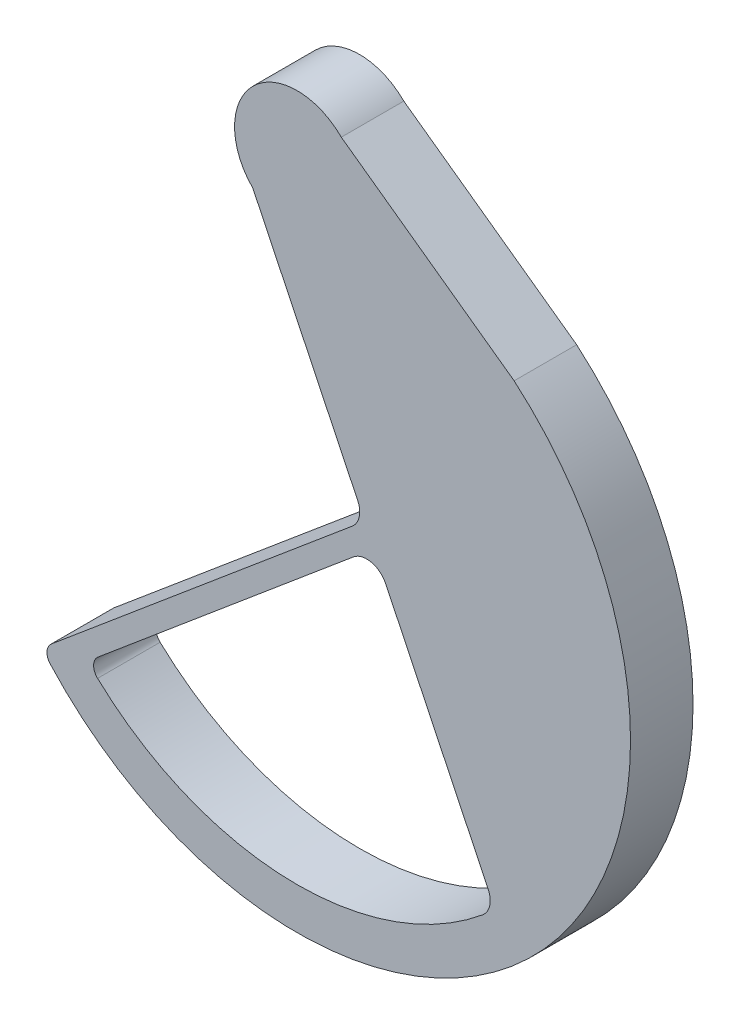
from build123d import *

# Parameters (mm, degrees)
EXTRUDE_1_DEPTH     = 15
SKETCH_9_R          = 10
CUT_EXTRUDE_3_DEPTH = 2


with BuildPart() as part:
    # ｽｹｯﾁ4 → ﾎﾞｽ - 押し出し1 (new body)
    with BuildSketch(Plane.XY):
        with BuildLine():
            Line((-53.623111018, -124.995132678), (-58.940636287, -129.45706617))
            ThreePointArc((-58.940636287, -129.45706617), (-60.005384698, -131.552012131), (-59.233530865, -133.771635843))
            ThreePointArc((-59.233530865, -133.771635843), (57.362306223, -135.763481103), (52.076178918, -19.270504783))
            Line((52.076178918, -19.270504783), (10.606601718, 10.606601718))
            ThreePointArc((10.606601718, 10.606601718), (-10.606601718, 10.606601718), (-10.606601718, -10.606601718))
            Line((-10.606601718, -10.606601718), (14.536280154, -62.889638219))
            ThreePointArc((14.536280154, -62.889638219), (14.918089499, -66.109676181), (13.244185189, -68.886809092))
            Line((13.244185189, -68.886809092), (-53.623111018, -124.995132678))
        make_face()
        with BuildLine():
            Line((21.232400696, -76.813798404), (45.844843506, -127.993820346))
            ThreePointArc((45.844843506, -127.993820346), (46.221944165, -131.235480845), (44.518718993, -134.019289696))
            ThreePointArc((44.518718993, -134.019289696), (-2.231208213, -149.964431749), (-47.870174388, -131.072951785))
            ThreePointArc((-47.870174388, -131.072951785), (-48.817477846, -128.802229421), (-47.747678417, -126.586582094))
            Line((-47.747678417, -126.586582094), (13.511229465, -75.151532228))
            ThreePointArc((13.511229465, -75.151532228), (17.77869109, -74.092739753), (21.232400696, -76.813798404))
        make_face(mode=Mode.SUBTRACT)
    extrude(amount=EXTRUDE_1_DEPTH)

    # ｽｹｯﾁ9 → ｶｯﾄ - 押し出し3 (cut)
    with BuildSketch(Plane(origin=(0, 0, 0), x_dir=(-1, 0, 0), z_dir=(0, 0, -1))):
        Circle(SKETCH_9_R)
    extrude(amount=-CUT_EXTRUDE_3_DEPTH, mode=Mode.SUBTRACT)


solid = part.part
